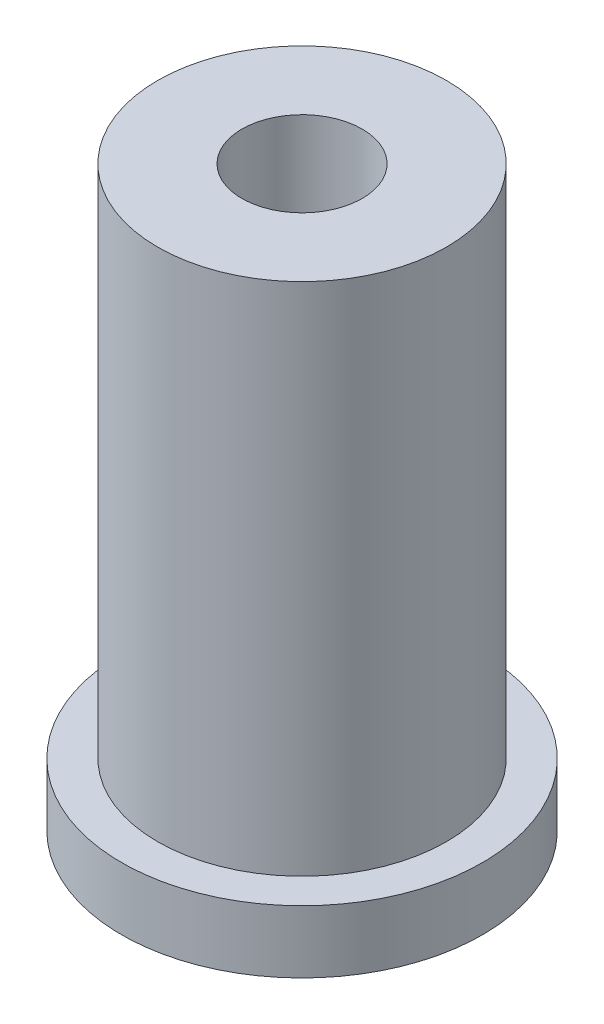
from build123d import *

# Parameters (mm, degrees)
SKETCH1_R           = 4.7625
BOSS_EXTRUDE1_DEPTH = 1.651
SKETCH2_R           = 3.81
BOSS_EXTRUDE2_DEPTH = 13.589
SKETCH3_R           = 1.5875
CUT_EXTRUDE2_DEPTH  = 17.66194504


with BuildPart() as part:
    # Sketch1 → Boss-Extrude1 (new body)
    with BuildSketch(Plane(origin=(0, 0, 0), x_dir=(1, 0, 0), z_dir=(0, 1, 0))):
        with Locations(Location((0, 0, 0), (0, 0, 90))):
            Circle(SKETCH1_R)
    extrude(amount=BOSS_EXTRUDE1_DEPTH)

    # Sketch2 → Boss-Extrude2 (add)
    with BuildSketch(Plane(origin=(0, 1.651, 0), x_dir=(1, 0, 0), z_dir=(0, 1, 0))):
        with Locations(Location((0, 0, 0), (0, 0, 270))):
            Circle(SKETCH2_R)
    extrude(amount=BOSS_EXTRUDE2_DEPTH)

    # Sketch3 → Cut-Extrude2 (cut, through all)
    with BuildSketch(Plane.XZ):
        with Locations(Location((0, 0, 0), (0, 0, 270))):
            Circle(SKETCH3_R)
    extrude(amount=-CUT_EXTRUDE2_DEPTH, mode=Mode.SUBTRACT)


solid = part.part
